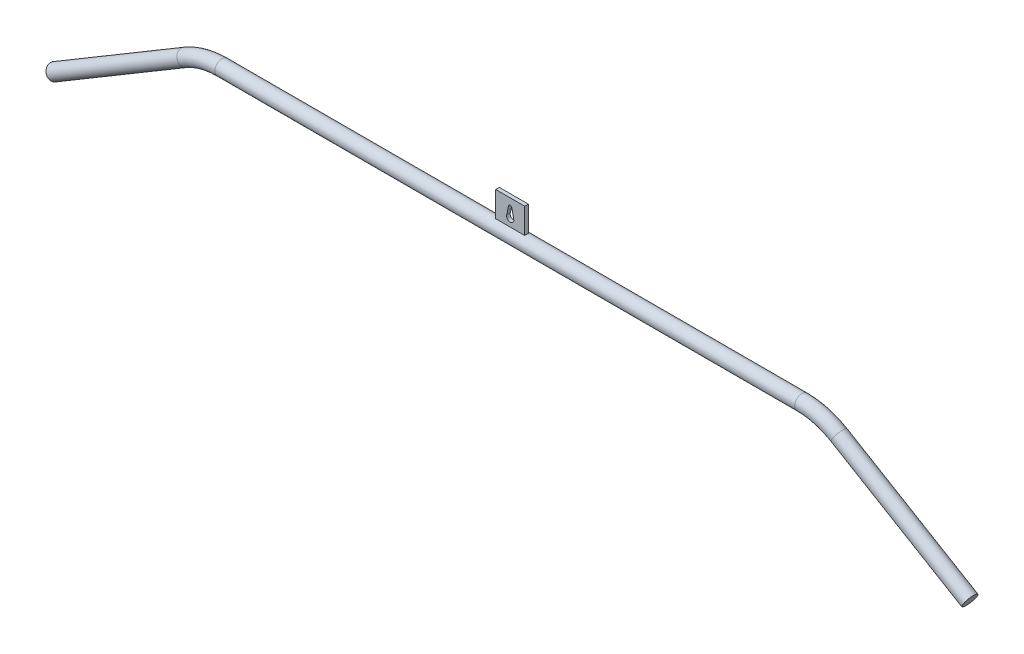
from build123d import *

# Parameters (mm, degrees)
SKETCH2_R           = 10
SKETCH3_W           = 40
SKETCH3_H           = 35
BOSS_EXTRUDE1_DEPTH = 2.5


with BuildPart() as part:
    # Sweep1: sweep along a path in Sketch1
    with BuildLine(Plane.XY) as sweep1_path:
        Line((0, 1.543839384), (400, 1.543839384))
        ThreePointArc((400, 1.543839384), (426.52707958, -2.038765666), (451.153438175, -12.529879637))
        Line((451.153438175, -12.529879637), (631.598628231, -119.952099804))
    # Sketch2 → Sweep1 (sweep)
    with BuildSketch(Plane(origin=(0, 0, 0), x_dir=(0, 0, -1), z_dir=(1, 0, 0))):
        with Locations((0, 1.543839384)):
            Circle(SKETCH2_R)
    sweep(path=sweep1_path.line)

    # Mirror1: part across plane


with BuildPart() as part_1:
    add(part.part)
    add(part.part.mirror(Plane(origin=(0, 1.543839384, 0), x_dir=(0, 0, 1), z_dir=(1, 0, 0))))


with BuildPart() as body_2:
    # Sketch3 → Boss-Extrude1 (new, symmetric)
    with BuildSketch(Plane.XY):
        with Locations((0, 29.043839384)):
            Rectangle(SKETCH3_W, SKETCH3_H)
        with BuildLine():
            ThreePointArc((2.520474072, 34.950049529), (0, 37.470523601), (-2.520474072, 34.950049529))
            Line((-2.520474072, 34.950049529), (-4.619864303, 24.355877315))
            ThreePointArc((-4.619864303, 24.355877315), (0, 17.452517565), (4.619864303, 24.355877315))
            Line((4.619864303, 24.355877315), (2.520474072, 34.950049529))
        make_face(mode=Mode.SUBTRACT)
    extrude(amount=BOSS_EXTRUDE1_DEPTH, both=True)


solid = Compound([part_1.part, body_2.part])
